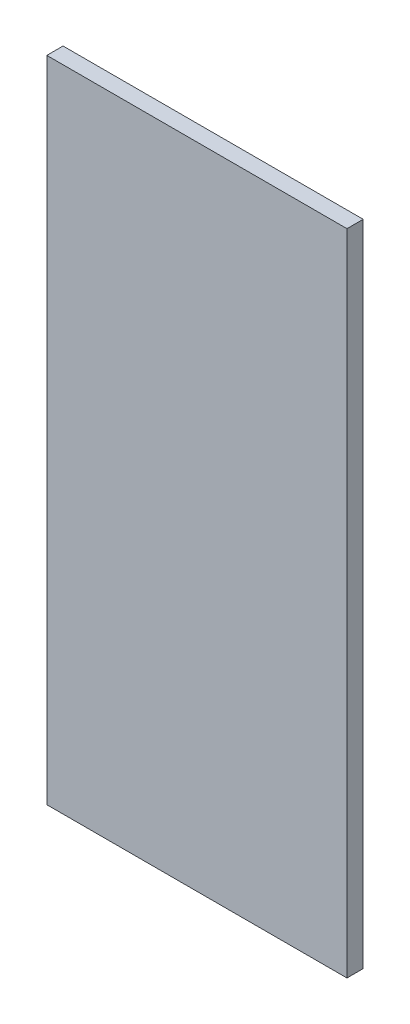
from build123d import *

# Parameters (mm, degrees)
SKETCH1_W           = 37
SKETCH1_H           = 80
BOSS_EXTRUDE1_DEPTH = 2


with BuildPart() as part:
    # Sketch1 → Boss-Extrude1 (new body)
    with BuildSketch(Plane.XY):
        with Locations((18.5, 40)):
            Rectangle(SKETCH1_W, SKETCH1_H)
    extrude(amount=BOSS_EXTRUDE1_DEPTH)


solid = part.part
